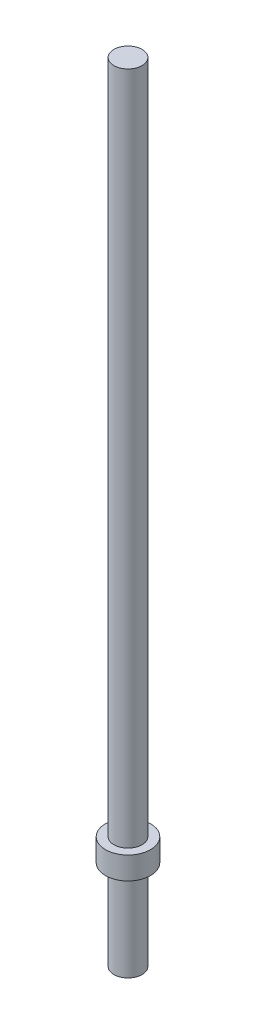
from build123d import *

# Parameters (mm, degrees)
SKETCH1_R           = 2.5
BOSS_EXTRUDE1_DEPTH = 120
SKETCH2_R           = 4
BOSS_EXTRUDE2_DEPTH = 4
BOSS_EXTRUDE3_START = -20
SKETCH3_R           = 2.5
BOSS_EXTRUDE3_DEPTH = 20


with BuildPart() as part:
    # Sketch1 → Boss-Extrude1 (new body)
    with BuildSketch(Plane(origin=(0, 0, 0), x_dir=(1, 0, 0), z_dir=(0, 1, 0))):
        with Locations(Location((0, 0, 0), (0, 0, 270))):
            Circle(SKETCH1_R)
    extrude(amount=BOSS_EXTRUDE1_DEPTH)

    # Sketch2 → Boss-Extrude2 (add)
    with BuildSketch(Plane(origin=(0, 0, 0), x_dir=(1, 0, 0), z_dir=(0, 1, 0))):
        with Locations(Location((0, 0, 0), (0, 0, 270))):
            Circle(SKETCH2_R)
    extrude(amount=-BOSS_EXTRUDE2_DEPTH)

    # Sketch3 → Boss-Extrude3 (add)
    with BuildSketch(Plane(origin=(0, 0, 0), x_dir=(1, 0, 0), z_dir=(0, 1, 0)).offset(BOSS_EXTRUDE3_START)):
        with Locations(Location((0, 0, 0), (0, 0, 270))):
            Circle(SKETCH3_R)
    extrude(amount=BOSS_EXTRUDE3_DEPTH)


solid = part.part
